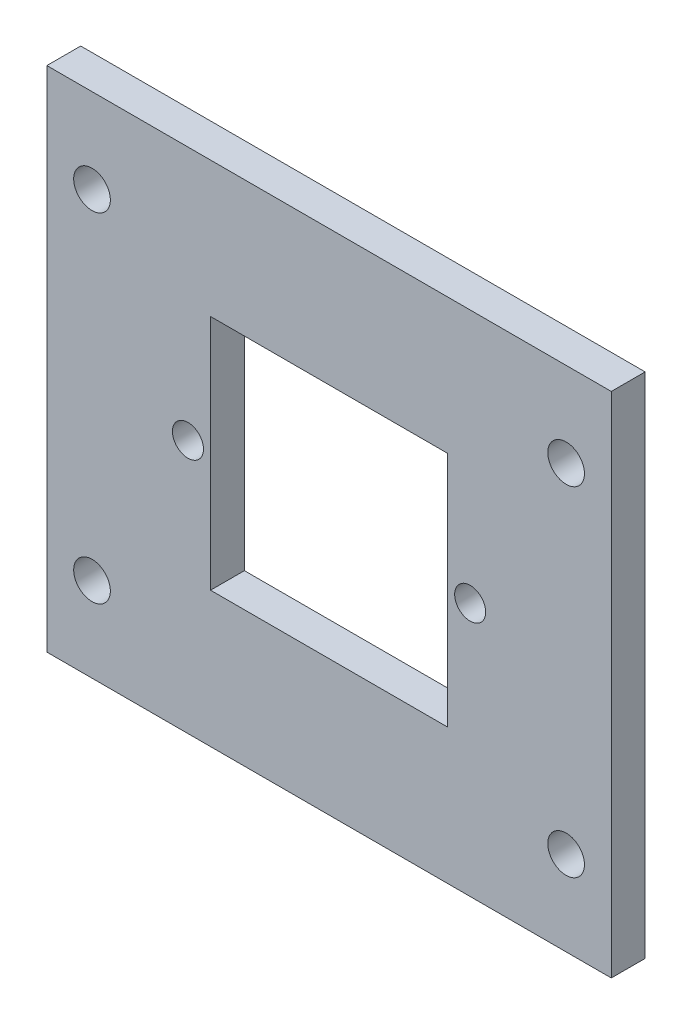
from build123d import *

# Parameters (mm, degrees)
SKETCH1_W           = 100
SKETCH1_H           = 90
BOSS_EXTRUDE1_DEPTH = 6
SKETCH2_R           = 2.75
SKETCH2_R_2         = 3.25
CUT_EXTRUDE1_DEPTH  = 68.53517602
SKETCH3_W           = 42
SKETCH3_H           = 42
CUT_EXTRUDE2_DEPTH  = 10


with BuildPart() as part:
    # Sketch1 → Boss-Extrude1 (new body)
    with BuildSketch(Plane.XY):
        Rectangle(SKETCH1_W, SKETCH1_H)
    extrude(amount=BOSS_EXTRUDE1_DEPTH)

    # Sketch2 → Cut-Extrude1 (cut, through all)
    with BuildSketch(Plane.XY.offset(6)):
        with Locations((-25, 0)):
            Circle(SKETCH2_R)
        with Locations((-42, 30)):
            Circle(SKETCH2_R_2)
        with Locations(Location((-42, -30, 0), (0, 0, 180))):
            Circle(SKETCH2_R_2)
        with Locations((42, -30)):
            Circle(SKETCH2_R_2)
        with Locations(Location((25, 0, 0), (0, 0, 180))):
            Circle(SKETCH2_R)
        with Locations(Location((42, 30, 0), (0, 0, 180))):
            Circle(SKETCH2_R_2)
    extrude(amount=-CUT_EXTRUDE1_DEPTH, mode=Mode.SUBTRACT)

    # Sketch3 → Cut-Extrude2 (cut)
    with BuildSketch(Plane.XY.offset(6)):
        Rectangle(SKETCH3_W, SKETCH3_H)
    extrude(amount=-CUT_EXTRUDE2_DEPTH, mode=Mode.SUBTRACT)


solid = part.part
